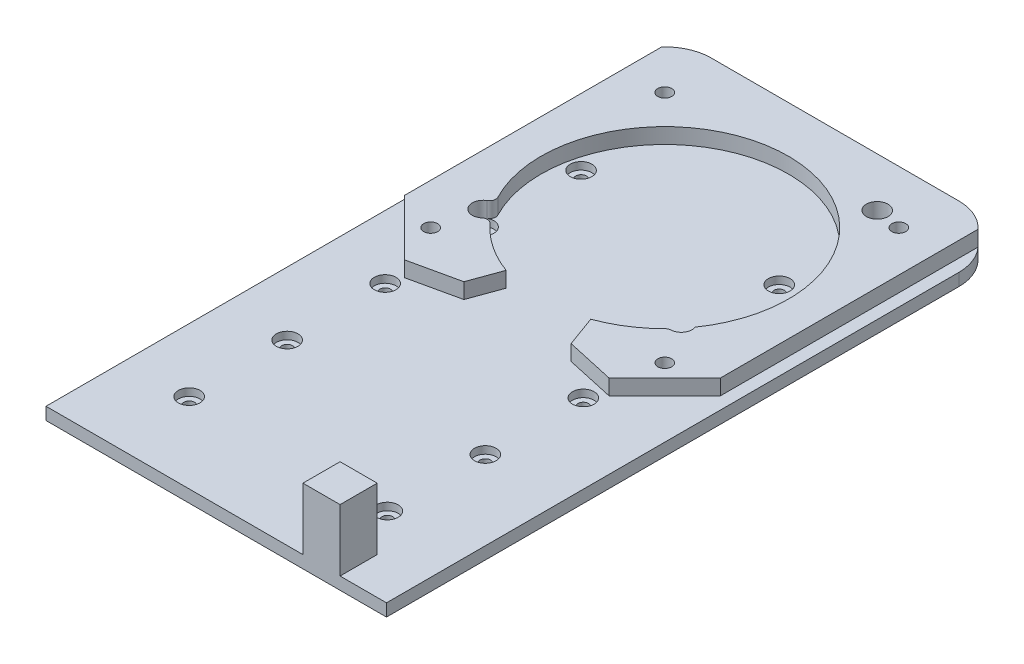
from build123d import *

# Parameters (mm, degrees)
ESQUISSE1_W                                        = 110.05441198
ESQUISSE1_H                                        = 4
BOSS_EXTRU_1_DEPTH                                 = 100
CHAMBRAGE_POUR_VIS_T_TE_RONDE_BOMB_E_M_D           = 3.4
CHAMBRAGE_POUR_VIS_T_TE_RONDE_BOMB_E_M_CBORE_D     = 7
CHAMBRAGE_POUR_VIS_T_TE_RONDE_BOMB_E_M_CBORE_DEPTH = 2.4
BOSS_EXTRU_2_START                                 = 5
ESQUISSE2_R                                        = 3.5
BOSS_EXTRU_2_DEPTH                                 = 5
CONG_1_R                                           = 15
DIAM_TRE_DU_PER_AGE_4_5_4_5_1_D                    = 4.5
R_P_TITION_CIRCULAIRE1_COUNT                       = 4
CONG_2_R                                           = 2
ESQUISSE12_W                                       = 12
ESQUISSE12_H                                       = 12
BOSS_EXTRU_3_DEPTH                                 = 20


with BuildPart() as part:
    # Esquisse1 → Boss.-Extru.1 (new, symmetric)
    with BuildSketch(Plane.XY):
        with Locations((0, -2)):
            Rectangle(ESQUISSE1_W, ESQUISSE1_H)
    extrude(amount=BOSS_EXTRU_1_DEPTH, both=True)

    # Chambrage pour vis à tête ronde bombée M31 (through all)
    with Locations(Plane(origin=(0, 0, 0), x_dir=(-1, 0, 0), z_dir=(0, 1, 0))):
        with Locations((-29.475226789, 74.166108561), (-29.475226789, 42.499553515), (-29.475226789, 10.83299847), (-29.475226789, -20.833556576), (-29.475226789, -52.500111621), (-29.475226789, -84.166666667), (34.58023462, -52.500111621), (34.58023462, -20.833556576), (34.58023462, 10.83299847), (34.58023462, 42.499553515), (34.58023462, 74.166108561)):
            CounterBoreHole(CHAMBRAGE_POUR_VIS_T_TE_RONDE_BOMB_E_M_D / 2, CHAMBRAGE_POUR_VIS_T_TE_RONDE_BOMB_E_M_CBORE_D / 2, CHAMBRAGE_POUR_VIS_T_TE_RONDE_BOMB_E_M_CBORE_DEPTH)

    # Esquisse2 → Boss.-Extru.2 (add)
    with BuildSketch(Plane(origin=(0, 0, 0), x_dir=(1, 0, 0), z_dir=(0, 1, 0)).offset(BOSS_EXTRU_2_START)):
        with BuildLine():
            ThreePointArc((-34.266288353, 24.319447816), (-30.921403648, 70.407647487), (13.653919587, 82.587588418))
            ThreePointArc((13.653919587, 82.587588418), (28.258676617, 73.282659801), (37.561941061, 58.676842631))
            ThreePointArc((37.561941061, 58.676842631), (39.631466487, 39.785625854), (32.749013114, 22.071426963))
            ThreePointArc((32.749013114, 22.071426963), (32.18281347, 18.615680482), (28.906205557, 17.380121353))
            ThreePointArc((28.906205557, 17.380121353), (21.853265177, 11.515003633), (13.649636645, 7.410852954))
            Line((13.649636645, 7.410852954), (17.29324483, -2.597524835))
            Line((17.29324483, -2.597524835), (33.030412308, -6.085123148))
            Line((33.030412308, -6.085123148), (51.056358534, 11.938098766))
            Line((51.056358534, 11.938098766), (51.056358534, 100))
            Line((51.056358534, 100), (-51.112329133, 100))
            Line((-51.112329133, 100), (-51.112329133, 11.942381707))
            Line((-51.112329133, 11.942381707), (-33.08910722, -6.083564519))
            Line((-33.08910722, -6.083564519), (-17.351939742, -2.595966207))
            Line((-17.351939742, -2.595966207), (-13.708331558, 7.412411582))
            ThreePointArc((-13.708331558, 7.412411582), (-23.310602668, 12.474879878), (-31.198165181, 19.932664624))
            ThreePointArc((-31.198165181, 19.932664624), (-37.448352421, 18.827590404), (-34.266288353, 24.319447816))
        make_face()
        with Locations(Location((29.475226789, 84.166666667, 0), (0, 0, 269.999999999))):
            Circle(ESQUISSE2_R, mode=Mode.SUBTRACT)
    extrude(amount=-BOSS_EXTRU_2_DEPTH)

    # Congé1
    cong_1_edges = [part.edges().sort_by_distance(p)[0] for p in [
        (55.02720599, -2, -100),
        (-55.02720599, -2, -100),
    ]]
    fillet(cong_1_edges, radius=CONG_1_R)

    # Diamètre du perçage Ø4.5 (4.5)1 (through all)
    with Locations(Plane(origin=(0, 5, 0), x_dir=(1, 0, 0), z_dir=(0, 1, 0))):
        with Locations((37.80586561, 7.172646225)):
            diam_tre_du_per_age_4_5_4_5_1 = Hole(DIAM_TRE_DU_PER_AGE_4_5_4_5_1_D / 2)

    # Répétition circulaire1: Diamètre du perçage Ø4.5 (4.5)1 ×4 about axis
    r_p_tition_circulaire1_axis = Axis((-0.027205985, 0, -45), (0, 1, 0))
    for i in range(1, R_P_TITION_CIRCULAIRE1_COUNT):
        add(diam_tre_du_per_age_4_5_4_5_1.rotate(r_p_tition_circulaire1_axis, i * 360 / R_P_TITION_CIRCULAIRE1_COUNT), mode=Mode.SUBTRACT)

    # Congé2
    cong_2_edges = [part.edges().sort_by_distance(p)[0] for p in [
        (-34.266288353, 2.5, -24.319447816),
        (28.906205557, 2.5, -17.380121353),
        (-31.198165181, 2.5, -19.932664624),
    ]]
    fillet(cong_2_edges, radius=CONG_2_R)

    # Esquisse12 → Boss.-Extru.3 (add)
    with BuildSketch(Plane(origin=(0, 0, 0), x_dir=(1, 0, 0), z_dir=(0, 1, 0))):
        with Locations((34.02720599, -94)):
            Rectangle(ESQUISSE12_W, ESQUISSE12_H)
    extrude(amount=BOSS_EXTRU_3_DEPTH)


solid = part.part
